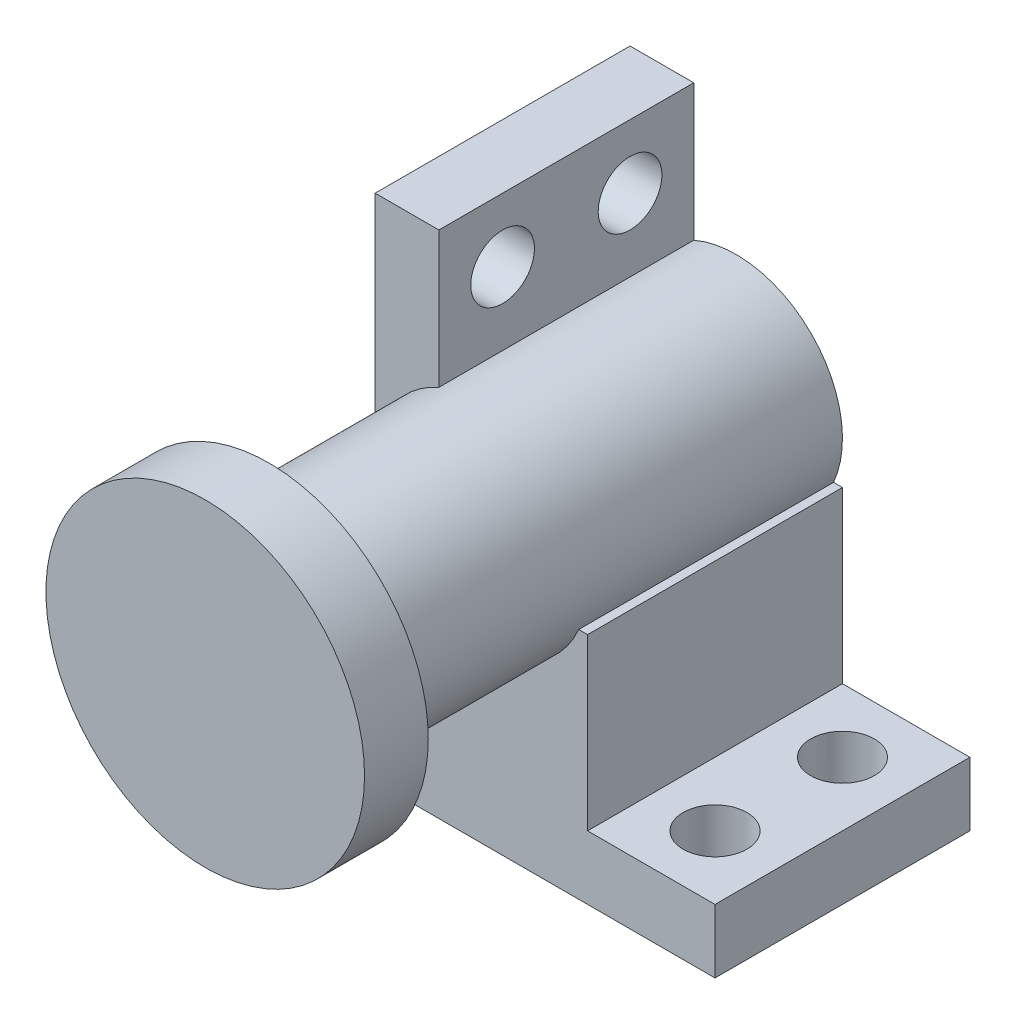
from build123d import *

# Parameters (mm, degrees)
SKETCH_1_W          = 5
SKETCH_1_H          = 8
EXTRUDE_1_DEPTH     = 12
SKETCH_2_R          = 5
EXTRUDE_2_DEPTH     = 10
SKETCH_3_R          = 7.5
EXTRUDE_3_DEPTH     = 3
SKETCH_4_R          = 1.5
CUT_EXTRUDE_1_DEPTH = 3
SKETCH_5_R          = 1.5
CUT_EXTRUDE_2_DEPTH = 11
SKETCH_6_W          = 6
SKETCH_6_H          = 12
CUT_EXTRUDE_3_DEPTH = 8


with BuildPart() as part:
    # 草图1 → 凸台-拉伸1 (new body)
    with BuildSketch(Plane.XY):
        with BuildLine():
            Line((11, -2), (4.582575695, -2))
            ThreePointArc((4.582575695, -2), (3.535533906, 3.535533906), (-2, 4.582575695))
            Line((-2, 4.582575695), (-2, 11))
            Line((-2, 11), (-5, 11))
            Line((-5, 11), (-5, 0))
            Line((-5, 0), (-5, -5))
            Line((-5, -5), (0, -5))
            Line((0, -5), (11, -5))
            Line((11, -5), (11, -2))
        make_face()
        Polygon((-5, -13), (-5, -5), (0, -5), (11, -5), (11, -13), align=None)
        with Locations((-2.5, -9)):
            Rectangle(SKETCH_1_W, SKETCH_1_H)
    extrude(amount=EXTRUDE_1_DEPTH)

    # 草图2 → 凸台-拉伸2 (add)
    with BuildSketch(Plane.XY.offset(12)):
        with Locations(Location((0, 0, 0), (0, 0, 180))):
            Circle(SKETCH_2_R)
    extrude(amount=EXTRUDE_2_DEPTH)

    # 草图3 → 凸台-拉伸3 (add)
    with BuildSketch(Plane.XY.offset(22)):
        Circle(SKETCH_3_R)
    extrude(amount=EXTRUDE_3_DEPTH)

    # 草图4 → 切除-拉伸1 (cut)
    with BuildSketch(Plane(origin=(-2, 0, 0), x_dir=(0, 0, -1), z_dir=(1, 0, 0))):
        with Locations(Location((-9, 7.998538294, 0), (0, 0, 90))):
            Circle(SKETCH_4_R)
        with Locations(Location((-3, 7.998538294, 0), (0, 0, 90))):
            Circle(SKETCH_4_R)
    extrude(amount=-CUT_EXTRUDE_1_DEPTH, mode=Mode.SUBTRACT)

    # 草图5 → 切除-拉伸2 (cut)
    with BuildSketch(Plane(origin=(0, -2, 0), x_dir=(1, 0, 0), z_dir=(0, 1, 0))):
        with Locations(Location((8, -9, 0), (0, 0, 270))):
            Circle(SKETCH_5_R)
        with Locations(Location((8, -3, 0), (0, 0, 270))):
            Circle(SKETCH_5_R)
    extrude(amount=-CUT_EXTRUDE_2_DEPTH, mode=Mode.SUBTRACT)

    # 草图6 → 切除-拉伸3 (cut)
    with BuildSketch(Plane(origin=(0, -2, 0), x_dir=(1, 0, 0), z_dir=(0, 1, 0))):
        with Locations((8, -6)):
            Rectangle(SKETCH_6_W, SKETCH_6_H)
    extrude(amount=-CUT_EXTRUDE_3_DEPTH, mode=Mode.SUBTRACT)


solid = part.part
